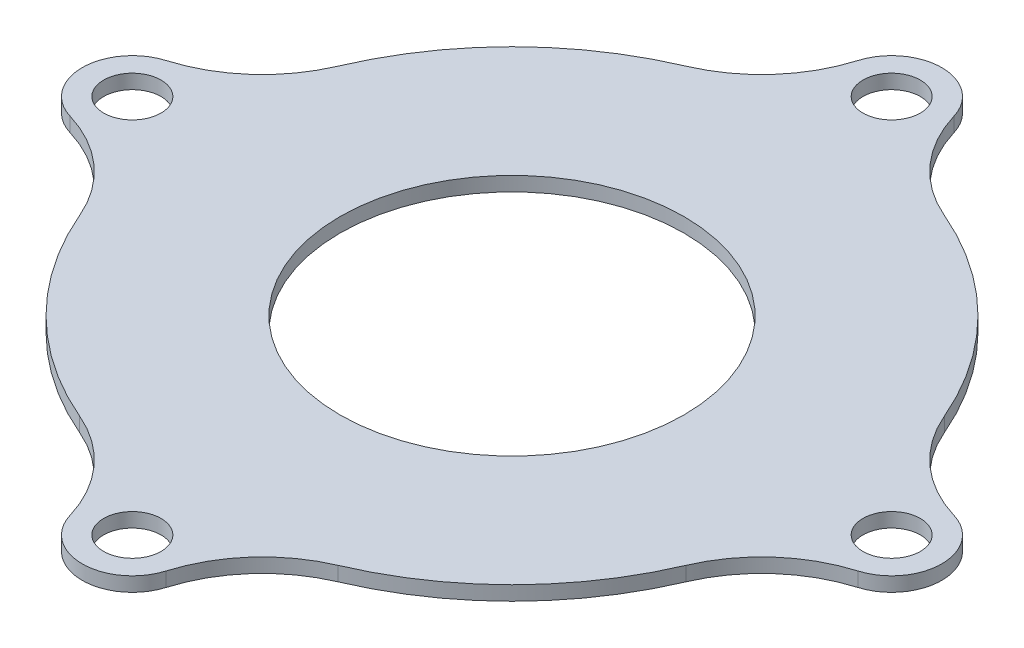
from build123d import *

# Parameters (mm, degrees)
SKETCH1_R           = 23
BOSS_EXTRUDE1_DEPTH = 3
SKETCH2_R           = 12
CUT_EXTRUDE1_DEPTH  = 10
SKETCH3_R           = 1.75
BOSS_EXTRUDE2_DEPTH = 3
SKETCH4_R           = 2.8
CUT_EXTRUDE2_DEPTH  = 1
FILLET1_R           = 10
SKETCH5_R           = 31.123463038
CUT_EXTRUDE3_DEPTH  = 1
CUT_EXTRUDE4_START  = -1
CUT_EXTRUDE4_DEPTH  = 1
SKETCH7_R           = 2.8
SKETCH7_R_2         = 2
BOSS_EXTRUDE3_DEPTH = 1


with BuildPart() as part:
    # Sketch1 → Boss-Extrude1 (new body)
    with BuildSketch(Plane(origin=(0, 0, 0), x_dir=(1, 0, 0), z_dir=(0, 1, 0))):
        with Locations(Location((0, 0, 0), (0, 0, 270))):
            Circle(SKETCH1_R)
    extrude(amount=BOSS_EXTRUDE1_DEPTH)

    # Sketch2 → Cut-Extrude1 (cut)
    with BuildSketch(Plane.XZ):
        with Locations(Location((0, 0, 0), (0, 0, 270))):
            Circle(SKETCH2_R)
    extrude(amount=-CUT_EXTRUDE1_DEPTH, mode=Mode.SUBTRACT)

    # Sketch3 → Boss-Extrude2 (add)
    # profile 1 of 4: a face of its own
    with BuildSketch(Plane.XZ):
        with BuildLine():
            Line((-26.5, 3.5), (-22.732135843, 3.5))
            ThreePointArc((-22.732135843, 3.5), (-23, 0), (-22.732135843, -3.5))
            Line((-22.732135843, -3.5), (-26.5, -3.5))
            ThreePointArc((-26.5, -3.5), (-30, 0), (-26.5, 3.5))
        make_face()
        with Locations(Location((-26.5, 0, 0), (0, 0, 270))):
            Circle(SKETCH3_R, mode=Mode.SUBTRACT)
    # profile 2 of 4: a face of its own
    with BuildSketch(Plane.XZ):
        with BuildLine():
            Line((3.5, 26.5), (3.5, 22.732135843))
            ThreePointArc((3.5, 22.732135843), (0, 23), (-3.5, 22.732135843))
            Line((-3.5, 22.732135843), (-3.5, 26.5))
            ThreePointArc((-3.5, 26.5), (0, 30), (3.5, 26.5))
        make_face()
        with Locations(Location((0, 26.5, 0), (0, 0, 270))):
            Circle(SKETCH3_R, mode=Mode.SUBTRACT)
    # profile 3 of 4: a face of its own
    with BuildSketch(Plane.XZ):
        with BuildLine():
            Line((26.5, -3.5), (22.732135843, -3.5))
            ThreePointArc((22.732135843, -3.5), (23, 0), (22.732135843, 3.5))
            Line((22.732135843, 3.5), (26.5, 3.5))
            ThreePointArc((26.5, 3.5), (30, 0), (26.5, -3.5))
        make_face()
        with Locations(Location((26.5, 0, 0), (0, 0, 270))):
            Circle(SKETCH3_R, mode=Mode.SUBTRACT)
    # profile 4 of 4: a face of its own
    with BuildSketch(Plane.XZ):
        with BuildLine():
            Line((-3.5, -26.5), (-3.5, -22.732135843))
            ThreePointArc((-3.5, -22.732135843), (0, -23), (3.5, -22.732135843))
            Line((3.5, -22.732135843), (3.5, -26.5))
            ThreePointArc((3.5, -26.5), (0, -30), (-3.5, -26.5))
        make_face()
        with Locations(Location((0, -26.5, 0), (0, 0, 270))):
            Circle(SKETCH3_R, mode=Mode.SUBTRACT)
    extrude(amount=-BOSS_EXTRUDE2_DEPTH)

    # Sketch4 → Cut-Extrude2 (cut)
    with BuildSketch(Plane.XZ):
        with Locations(Location((-26.5, 0, 0), (0, 0, 270))):
            Circle(SKETCH4_R)
        with Locations(Location((0, 26.5, 0), (0, 0, 270))):
            Circle(SKETCH4_R)
        with Locations(Location((26.5, 0, 0), (0, 0, 270))):
            Circle(SKETCH4_R)
        with Locations(Location((0, -26.5, 0), (0, 0, 270))):
            Circle(SKETCH4_R)
    extrude(amount=-CUT_EXTRUDE2_DEPTH, mode=Mode.SUBTRACT)

    # Fillet1
    fillet1_edges = [part.edges().sort_by_distance(p)[0] for p in [
        (3.5, 1.5, 22.732135843),
        (22.732135843, 1.5, 3.5),
        (22.732135843, 1.5, -3.5),
        (3.5, 1.5, -22.732135843),
        (-3.5, 1.5, -22.732135843),
        (-22.732135843, 1.5, -3.5),
        (-22.732135843, 1.5, 3.5),
        (-3.5, 1.5, 22.732135843),
    ]]
    fillet(fillet1_edges, radius=FILLET1_R)

    # Sketch5 → Cut-Extrude3 (cut)
    with BuildSketch(Plane(origin=(0, 3, 0), x_dir=(1, 0, 0), z_dir=(0, 1, 0))):
        Circle(SKETCH5_R)
    extrude(amount=-CUT_EXTRUDE3_DEPTH, mode=Mode.SUBTRACT)

    # Sketch6 → Cut-Extrude4 (cut)
    with BuildSketch(Plane(origin=(0, 2, 0), x_dir=(1, 0, 0), z_dir=(0, 1, 0)).offset(CUT_EXTRUDE4_START)):
        with BuildLine():
            ThreePointArc((3.353997774, 27.500349406), (5.477838975, 23.697921815), (9.016591418, 21.15894797))
            ThreePointArc((9.016591418, 21.15894797), (16.263455967, 16.263455967), (21.15894797, 9.016591418))
            ThreePointArc((21.15894797, 9.016591418), (23.697921815, 5.477838975), (27.500349406, 3.353997774))
            ThreePointArc((27.500349406, 3.353997774), (30, 0), (27.500349406, -3.353997774))
            ThreePointArc((27.500349406, -3.353997774), (23.697921815, -5.477838975), (21.15894797, -9.016591418))
            ThreePointArc((21.15894797, -9.016591418), (16.263455967, -16.263455967), (9.016591418, -21.15894797))
            ThreePointArc((9.016591418, -21.15894797), (5.477838975, -23.697921815), (3.353997774, -27.500349406))
            ThreePointArc((3.353997774, -27.500349406), (0, -30), (-3.353997774, -27.500349406))
            ThreePointArc((-3.353997774, -27.500349406), (-5.477838975, -23.697921815), (-9.016591418, -21.15894797))
            ThreePointArc((-9.016591418, -21.15894797), (-16.263455967, -16.263455967), (-21.15894797, -9.016591418))
            ThreePointArc((-21.15894797, -9.016591418), (-23.697921815, -5.477838975), (-27.500349406, -3.353997774))
            ThreePointArc((-27.500349406, -3.353997774), (-30, 0), (-27.500349406, 3.353997774))
            ThreePointArc((-27.500349406, 3.353997774), (-23.697921815, 5.477838975), (-21.15894797, 9.016591418))
            ThreePointArc((-21.15894797, 9.016591418), (-16.263455967, 16.263455967), (-9.016591418, 21.15894797))
            ThreePointArc((-9.016591418, 21.15894797), (-5.477838975, 23.697921815), (-3.353997774, 27.500349406))
            ThreePointArc((-3.353997774, 27.500349406), (0, 30), (3.353997774, 27.500349406))
        make_face()
    extrude(amount=CUT_EXTRUDE4_DEPTH, mode=Mode.SUBTRACT)

    # Sketch7 → Boss-Extrude3 (add)
    # profile 1 of 4: a face of its own
    with BuildSketch(Plane.XZ):
        with Locations((0, 26.5)):
            Circle(SKETCH7_R)
        with Locations(Location((0, 26.5, 0), (0, 0, 270))):
            Circle(SKETCH7_R_2, mode=Mode.SUBTRACT)
    # profile 2 of 4: a face of its own
    with BuildSketch(Plane.XZ):
        with Locations((26.5, 0)):
            Circle(SKETCH7_R)
        with Locations(Location((26.5, 0, 0), (0, 0, 270))):
            Circle(SKETCH7_R_2, mode=Mode.SUBTRACT)
    # profile 3 of 4: a face of its own
    with BuildSketch(Plane.XZ):
        with Locations((0, -26.5)):
            Circle(SKETCH7_R)
        with Locations(Location((0, -26.5, 0), (0, 0, 270))):
            Circle(SKETCH7_R_2, mode=Mode.SUBTRACT)
    # profile 4 of 4: a face of its own
    with BuildSketch(Plane.XZ):
        with Locations((-26.5, 0)):
            Circle(SKETCH7_R)
        with Locations(Location((-26.5, 0, 0), (0, 0, 270))):
            Circle(SKETCH7_R_2, mode=Mode.SUBTRACT)
    extrude(amount=-BOSS_EXTRUDE3_DEPTH)


solid = part.part
